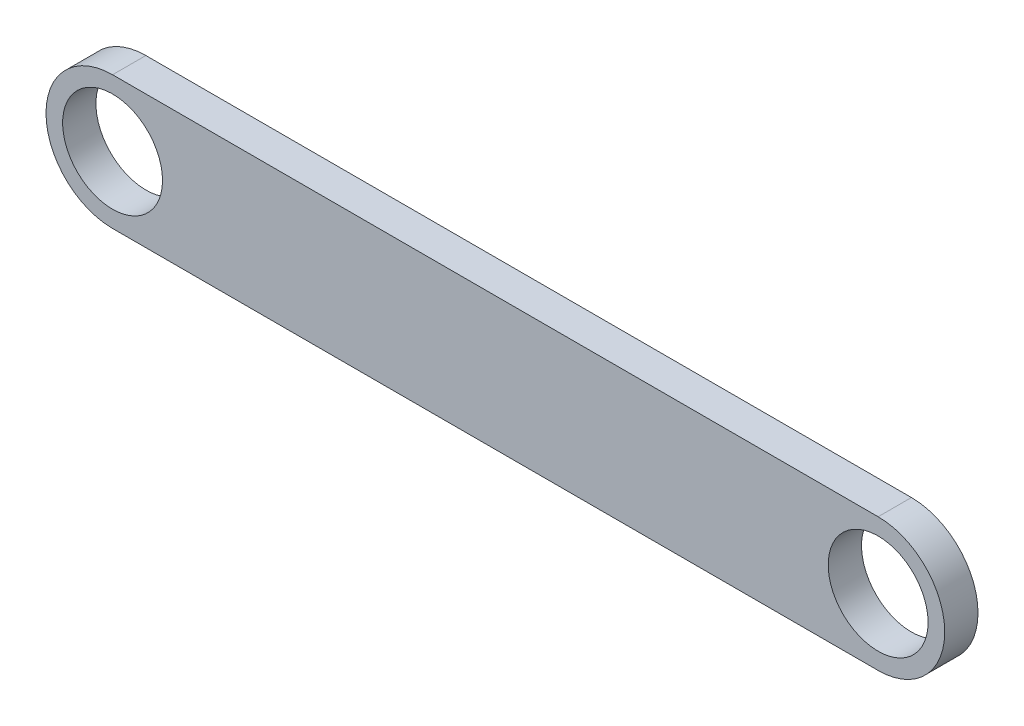
from build123d import *

# Parameters (mm, degrees)
SKETCH_1_R      = 15
EXTRUDE_1_DEPTH = 10


with BuildPart() as part:
    # Эскиз1 → Бобышка-Вытянуть1 (new body)
    with BuildSketch(Plane.XY):
        with BuildLine():
            Line((0, 20), (230, 20))
            ThreePointArc((230, 20), (250, 0), (230, -20))
            Line((230, -20), (0, -20))
            ThreePointArc((0, -20), (-20, 0), (0, 20))
        make_face()
        Circle(SKETCH_1_R, mode=Mode.SUBTRACT)
        with Locations((230, 0)):
            Circle(SKETCH_1_R, mode=Mode.SUBTRACT)
    extrude(amount=EXTRUDE_1_DEPTH)


solid = part.part
